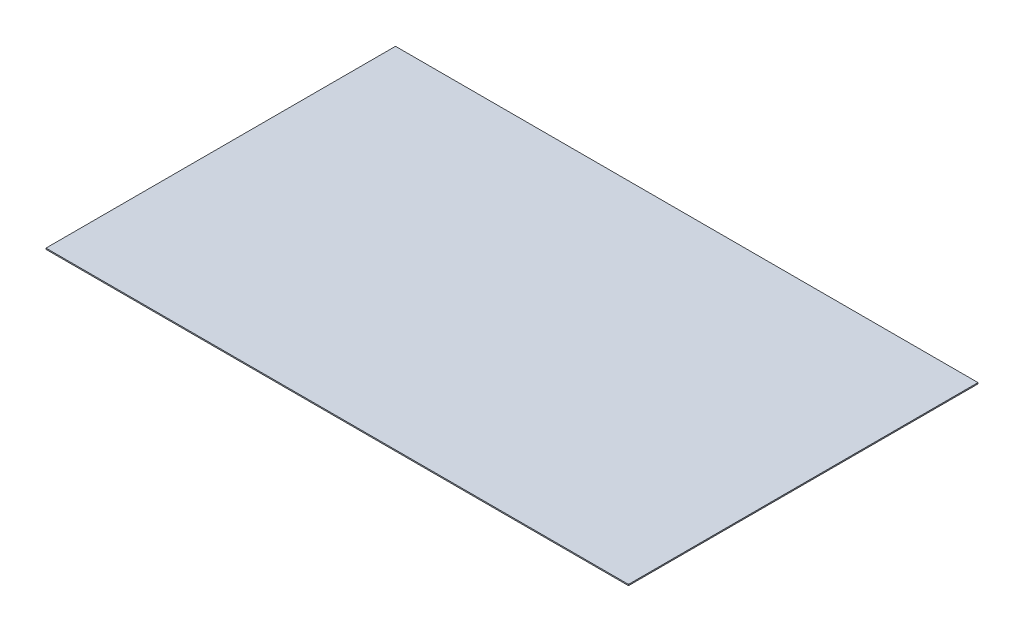
from build123d import *

# Parameters (mm, degrees)
SKETCH1_W           = 5000
SKETCH1_H           = 3000
BOSS_EXTRUDE1_DEPTH = 10


with BuildPart() as part:
    # Sketch1 → Boss-Extrude1 (new body)
    with BuildSketch(Plane(origin=(0, 0, 0), x_dir=(1, 0, 0), z_dir=(0, 1, 0))):
        with Locations((2431.040589019, -1464.709007322)):
            Rectangle(SKETCH1_W, SKETCH1_H)
    extrude(amount=BOSS_EXTRUDE1_DEPTH)


solid = part.part
